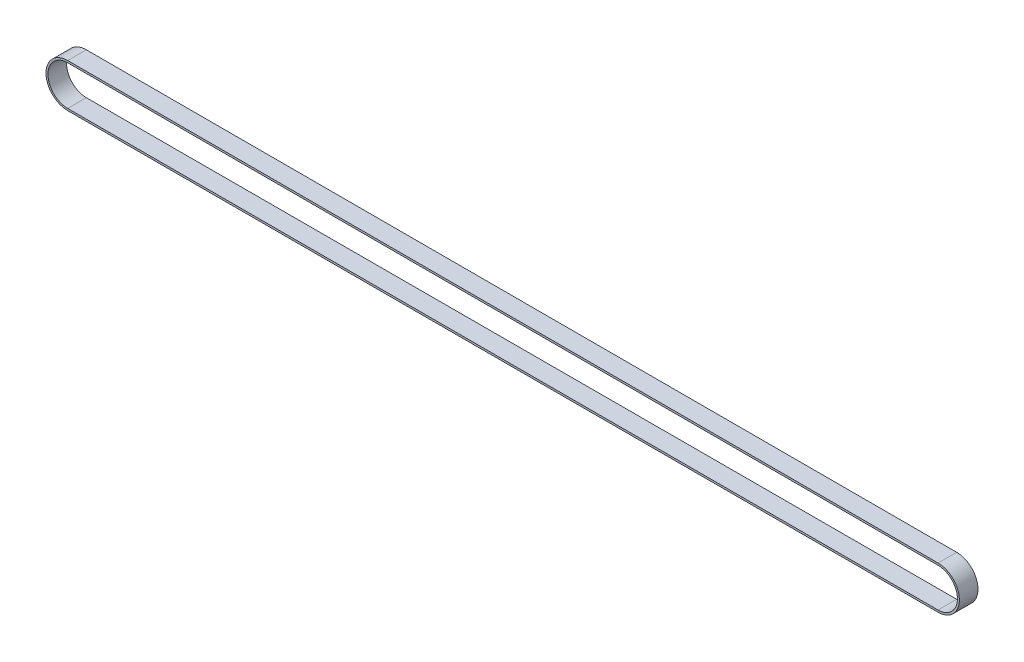
from build123d import *

# Parameters (mm, degrees)
SALIENTE_EXTRUIR1_DEPTH = 6


with BuildPart() as part:
    # Croquis1 → Saliente-Extruir1 (new body)
    with BuildSketch(Plane.XY):
        with BuildLine():
            Line((255.64723017, 6.986512672), (-24.752741521, 6.986512672))
            ThreePointArc((-24.752741521, 6.986512672), (-31.748741521, -0.009487328), (-24.752741521, -7.005487328))
            Line((-24.752741521, -7.005487328), (255.65340428, -6.753484553))
            ThreePointArc((255.65340428, -6.753484553), (262.517229476, 0.119599728), (255.64723017, 6.986512672))
        make_face()
        with BuildLine():
            Line((-24.752741521, 6.356512672), (255.64723017, 6.356512672))
            ThreePointArc((255.64723017, 6.356512672), (261.88723017, 0.116512672), (255.64723017, -6.123487328))
            Line((255.64723017, -6.123487328), (-24.752741521, -6.375487328))
            ThreePointArc((-24.752741521, -6.375487328), (-31.118741521, -0.009487328), (-24.752741521, 6.356512672))
        make_face(mode=Mode.SUBTRACT)
    extrude(amount=SALIENTE_EXTRUIR1_DEPTH)


solid = part.part
